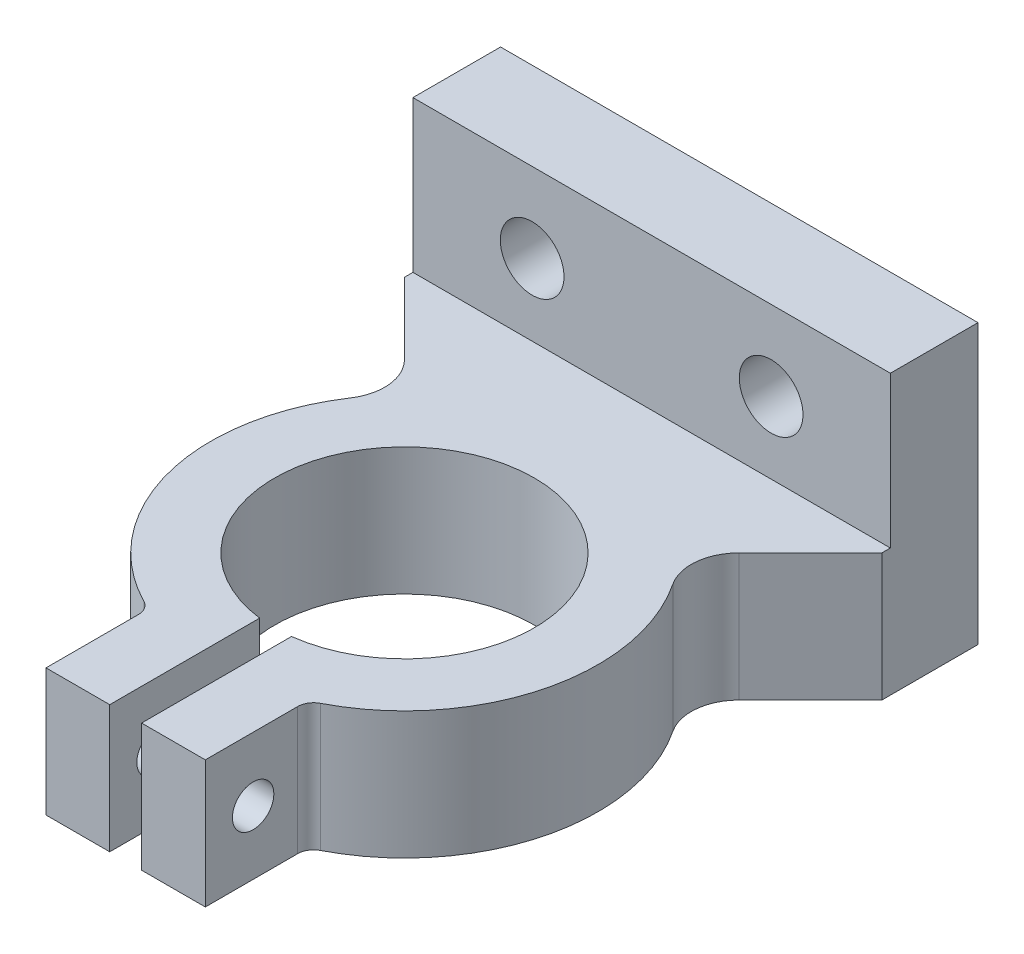
from build123d import *

# Parameters (mm, degrees)
EXTRUDE_THIN1_DEPTH     = 60
BOSS_EXTRUDE1_DEPTH     = 16
CUT_EXTRUDE1_DEPTH      = 105.764405022
CUT_EXTRUDE2_DEPTH      = 112.059105885
FILLET2_R               = 2
CUT_EXTRUDE3_DEPTH      = 112.059105885
CUT_EXTRUDE3_DEPTH_BACK = 112.059105885
SKETCH6_R               = 2.6
CUT_EXTRUDE4_DEPTH      = 105.764405022
CUT_EXTRUDE4_DEPTH_BACK = 105.764405022
SKETCH7_W               = 78.423709943
SKETCH7_H               = 52.802383793
SKETCH8_W               = 51.319796382
SKETCH8_H               = 40.051163843
BOSS_EXTRUDE2_DEPTH     = 16
SKETCH9_W               = 91.777168916
SKETCH9_H               = 33.81264118
CUT_EXTRUDE5_DEPTH      = 95.816269701
SKETCH12_W              = 62.932503526
SKETCH12_H              = 35
SKETCH12_R              = 4
BOSS_EXTRUDE5_DEPTH     = 11
CUT_EXTRUDE6_DEPTH      = 96.368364776
CUT_EXTRUDE6_DEPTH_BACK = 96.368364776
SKETCH13_W              = 157.086871367
SKETCH13_H              = 169.783274599
SKETCH13_W_2            = 59.932503526
SKETCH13_H_2            = 122.233999749
FILLET6_R               = 6
SKETCH14_R              = 1.75
CUT_EXTRUDE7_DEPTH      = 15
CUT_EXTRUDE8_DEPTH      = 30


with BuildPart() as part:
    # Sketch1 → Extrude-Thin1 (new body)
    with BuildSketch(Plane(origin=(0, 0, 0), x_dir=(1, 0, 0), z_dir=(0, 1, 0))):
        Polygon((-28.637824638, -0.353553391), (0, -28.991378029), (28.637824638, -0.353553391), (31.466251763, -3.181980515), (0, -34.648232278), (-31.466251763, -3.181980515), align=None)
    extrude(amount=EXTRUDE_THIN1_DEPTH)

    # Sketch2 → Boss-Extrude1 (add)
    with BuildSketch(Plane(origin=(0, 0, 0), x_dir=(1, 0, 0), z_dir=(0, 1, 0))):
        with BuildLine():
            Line((-31.466251763, -3.181980515), (-31.466251763, -88))
            Line((-31.466251763, -88), (-2, -88))
            Line((-2, -88), (-2, -69.17683529))
            ThreePointArc((-2, -69.17683529), (0, -36.7), (2, -69.17683529))
            Line((2, -69.17683529), (2, -88))
            Line((2, -88), (31.466251763, -88))
            Line((31.466251763, -88), (31.466251763, -3.181980515))
            Line((31.466251763, -3.181980515), (0, -34.648232278))
            Line((0, -34.648232278), (-31.466251763, -3.181980515))
        make_face()
    extrude(amount=BOSS_EXTRUDE1_DEPTH)

    # Sketch3 → Cut-Extrude1 (cut, through all)
    with BuildSketch(Plane(origin=(17.324116139, 0, 17.324116139), x_dir=(0.7071067811865475, 0, -0.7071067811865476), z_dir=(0.7071067811865476, 0, 0.7071067811865475))):
        with BuildLine():
            Line((2.75, 50), (2.75, 20))
            ThreePointArc((2.75, 20), (0, 17.25), (-2.75, 20))
            Line((-2.75, 20), (-2.75, 50))
            ThreePointArc((-2.75, 50), (0, 52.75), (2.75, 50))
        make_face()
    cut_extrude1 = extrude(amount=-CUT_EXTRUDE1_DEPTH, mode=Mode.SUBTRACT)

    # Mirror1: Cut-Extrude1 across plane
    add(cut_extrude1.mirror(Plane(origin=(0, 0, 0), x_dir=(0, 0, 1), z_dir=(1, 0, 0))), mode=Mode.SUBTRACT)

    # Sketch5 → Cut-Extrude2 (cut, through all)
    with BuildSketch(Plane(origin=(0, 0, 0), x_dir=(1, 0, 0), z_dir=(0, 1, 0))):
        with BuildLine():
            Line((-31.466251763, -21.533748237), (-17.182694783, -35.817305217))
            ThreePointArc((-17.182694783, -35.817305217), (-23.904625503, -57.365647669), (-10, -75.147008827))
            Line((-10, -75.147008827), (-10, -88))
            Line((-10, -88), (-31.466251763, -88))
            Line((-31.466251763, -88), (-31.466251763, -21.533748237))
        make_face()
    cut_extrude2 = extrude(amount=CUT_EXTRUDE2_DEPTH, mode=Mode.SUBTRACT)

    # Mirror2: Cut-Extrude2 across plane
    add(cut_extrude2.mirror(Plane(origin=(0, 0, 0), x_dir=(0, 0, 1), z_dir=(1, 0, 0))), mode=Mode.SUBTRACT)

    # Fillet2
    fillet2_edges = [part.edges().sort_by_distance(p)[0] for p in [
        (10, 8, 75.147008827),
        (-10, 8, 75.147008827),
    ]]
    fillet(fillet2_edges, radius=FILLET2_R)

    # Sketch6 → Cut-Extrude3 (cut, two sides: drawn at the far end of the back side and taken through both)
    with BuildSketch(Plane(origin=(0, 0, 0), x_dir=(0, 0, -1), z_dir=(1, 0, 0)).offset(-CUT_EXTRUDE3_DEPTH_BACK)):
        with Locations((-82, 8)):
            Circle(SKETCH6_R)
    extrude(amount=CUT_EXTRUDE3_DEPTH + CUT_EXTRUDE3_DEPTH_BACK, mode=Mode.SUBTRACT)

    # Sketch7 → Cut-Extrude4 (cut, two sides: drawn at the far end of the back side and taken through both)
    with BuildSketch(Plane(origin=(-17.324116139, 0, 17.324116139), x_dir=(0.7071067811865475, 0, 0.7071067811865476), z_dir=(-0.7071067811865476, 0, 0.7071067811865475)).offset(-CUT_EXTRUDE4_DEPTH_BACK)):
        with Locations((-0.892385334, 42.401191897)):
            Rectangle(SKETCH7_W, SKETCH7_H)
    extrude(amount=CUT_EXTRUDE4_DEPTH + CUT_EXTRUDE4_DEPTH_BACK, mode=Mode.SUBTRACT)

    # Sketch8 → Boss-Extrude2 (add)
    with BuildSketch(Plane(origin=(0, 16, 0), x_dir=(1, 0, 0), z_dir=(0, 1, 0))):
        with Locations((0.329762311, -10.635090251)):
            Rectangle(SKETCH8_W, SKETCH8_H)
    extrude(amount=-BOSS_EXTRUDE2_DEPTH)

    # Sketch9 → Cut-Extrude5 (cut, through all)
    with BuildSketch(Plane(origin=(0, 16, 0), x_dir=(1, 0, 0), z_dir=(0, 1, 0))):
        with Locations((0.452847873, -5.06743142)):
            Rectangle(SKETCH9_W, SKETCH9_H)
    extrude(amount=-CUT_EXTRUDE5_DEPTH, mode=Mode.SUBTRACT)

    # Sketch12 → Boss-Extrude5 (add)
    with BuildSketch(Plane(origin=(0, 0, 21.97375201), x_dir=(-1, 0, 0), z_dir=(0, 0, -1))):
        with Locations((0, 17.5)):
            Rectangle(SKETCH12_W, SKETCH12_H)
        with Locations((-15, 25)):
            Circle(SKETCH12_R, mode=Mode.SUBTRACT)
        with Locations((15, 25)):
            Circle(SKETCH12_R, mode=Mode.SUBTRACT)
    extrude(amount=BOSS_EXTRUDE5_DEPTH)

    # Sketch13 → Cut-Extrude6 (cut, two sides: drawn at the far end of the back side and taken through both)
    with BuildSketch(Plane(origin=(0, 16, 0), x_dir=(1, 0, 0), z_dir=(0, 1, 0)).offset(-CUT_EXTRUDE6_DEPTH_BACK)):
        with Locations((-2.365016289, -53.735825088)):
            Rectangle(SKETCH13_W, SKETCH13_H)
        with Locations((0, -51.3708088)):
            Rectangle(SKETCH13_W_2, SKETCH13_H_2, mode=Mode.SUBTRACT)
    extrude(amount=CUT_EXTRUDE6_DEPTH + CUT_EXTRUDE6_DEPTH_BACK, mode=Mode.SUBTRACT)

    # Fillet6
    fillet6_edges = [part.edges().sort_by_distance(p)[0] for p in [
        (17.182694783, 8, 35.817305217),
        (-17.182694783, 8, 35.817305217),
    ]]
    fillet(fillet6_edges, radius=FILLET6_R)

    # Sketch14 → Cut-Extrude7 (cut)
    with BuildSketch(Plane(origin=(0, 0, 10.97375201), x_dir=(-1, 0, 0), z_dir=(0, 0, -1))):
        with Locations((0, 10)):
            Circle(SKETCH14_R)
    extrude(amount=-CUT_EXTRUDE7_DEPTH, mode=Mode.SUBTRACT)

    # Sketch15 → Cut-Extrude8 (cut)
    with BuildSketch(Plane(origin=(0, 16, 0), x_dir=(1, 0, 0), z_dir=(0, 1, 0))):
        Polygon((25.989660502, -27.010339498), (22.339327827, -30.660672173), (25.989660502, -30.660672173), align=None)
        Polygon((-25.989660502, -30.660672173), (-25.989660502, -27.010339498), (-22.339327827, -30.660672173), align=None)
    extrude(amount=-CUT_EXTRUDE8_DEPTH, mode=Mode.SUBTRACT)


solid = part.part
